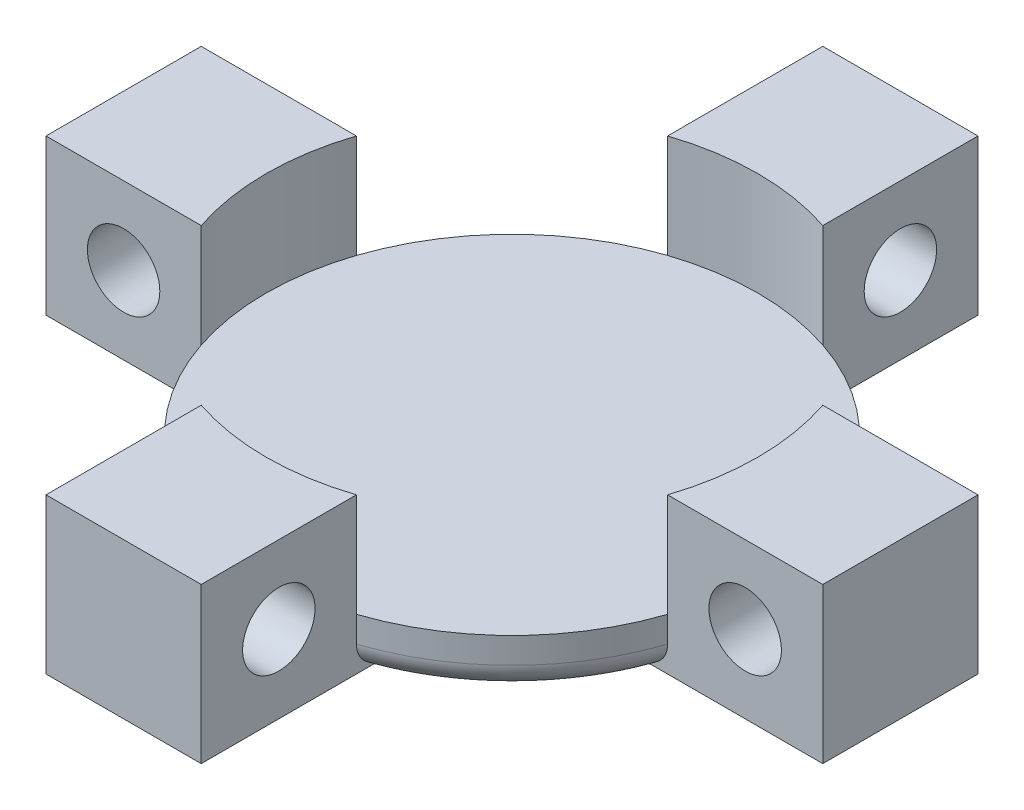
from build123d import *

# Parameters (mm, degrees)
SKETCH2_R           = 12.065
BOSS_EXTRUDE1_DEPTH = 2.54
BOSS_EXTRUDE2_DEPTH = 7.62
CIRPATTERN1_COUNT   = 4
SKETCH4_R           = 1.778
CUT_EXTRUDE1_DEPTH  = 7.62
CIRPATTERN2_COUNT   = 4
FILLET1_R           = 1.27


with BuildPart() as part:
    # Sketch2 → Boss-Extrude1 (new body)
    with BuildSketch(Plane(origin=(0, 0, 0), x_dir=(1, 0, 0), z_dir=(0, 1, 0))):
        with Locations(Location((0, 0, 0), (0, 0, 270))):
            Circle(SKETCH2_R)
    extrude(amount=BOSS_EXTRUDE1_DEPTH)

    # Sketch3 → Boss-Extrude2 (add)
    with BuildSketch(Plane(origin=(0, 0, 0), x_dir=(1, 0, 0), z_dir=(0, 1, 0))):
        with BuildLine():
            Line((-11.4476253, 3.81), (-19.0676253, 3.81))
            Line((-19.0676253, 3.81), (-19.0676253, -3.81))
            Line((-19.0676253, -3.81), (-11.4476253, -3.81))
            ThreePointArc((-11.4476253, -3.81), (-12.065, 0), (-11.4476253, 3.81))
        make_face()
    boss_extrude2 = extrude(amount=BOSS_EXTRUDE2_DEPTH)

    # CirPattern1: Boss-Extrude2 ×4 about axis
    cirpattern1_axis = Axis((0, 0, 0), (0, 1, 0))
    for i in range(1, CIRPATTERN1_COUNT):
        add(boss_extrude2.rotate(cirpattern1_axis, i * 360 / CIRPATTERN1_COUNT))

    # Sketch4 → Cut-Extrude1 (cut)
    with BuildSketch(Plane.XY.offset(3.81)):
        with Locations((-15.2576253, 3.81)):
            Circle(SKETCH4_R)
    cut_extrude1 = extrude(amount=-CUT_EXTRUDE1_DEPTH, mode=Mode.SUBTRACT)

    # CirPattern2: Cut-Extrude1 ×4 about axis
    cirpattern2_axis = Axis((0, 2.54, 0), (0, -1, 0))
    for i in range(1, CIRPATTERN2_COUNT):
        add(cut_extrude1.rotate(cirpattern2_axis, i * 360 / CIRPATTERN2_COUNT), mode=Mode.SUBTRACT)

    # Fillet1
    fillet1_edges = [part.edges().sort_by_distance(p)[0] for p in [
        (8.531243315, 0, 8.531243315),
        (8.531243315, 0, -8.531243315),
        (-8.531243315, 0, -8.531243315),
        (-8.531243315, 0, 8.531243315),
    ]]
    fillet(fillet1_edges, radius=FILLET1_R)


solid = part.part
